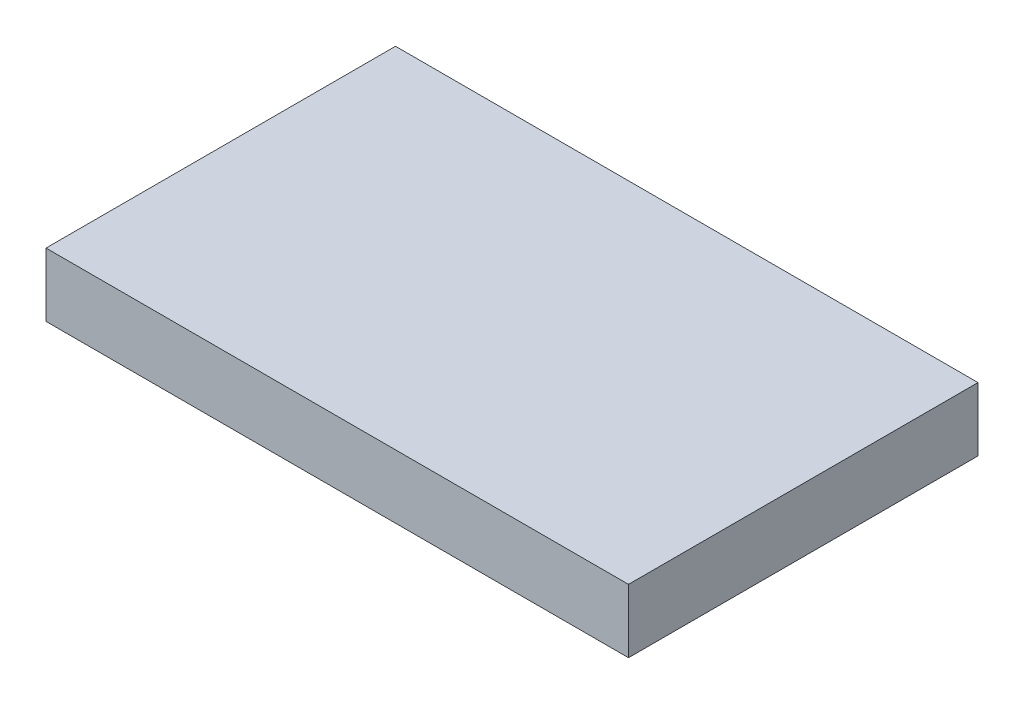
from build123d import *

# Parameters (mm, degrees)
SKETCH_1_W      = 27.5
SKETCH_1_H      = 16.5
EXTRUDE_1_DEPTH = 3


with BuildPart() as part:
    # 草图1 → 凸台-拉伸1 (new body)
    with BuildSketch(Plane(origin=(0, 0, 0), x_dir=(1, 0, 0), z_dir=(0, 1, 0))):
        Rectangle(SKETCH_1_W, SKETCH_1_H)
    extrude(amount=EXTRUDE_1_DEPTH)


solid = part.part
